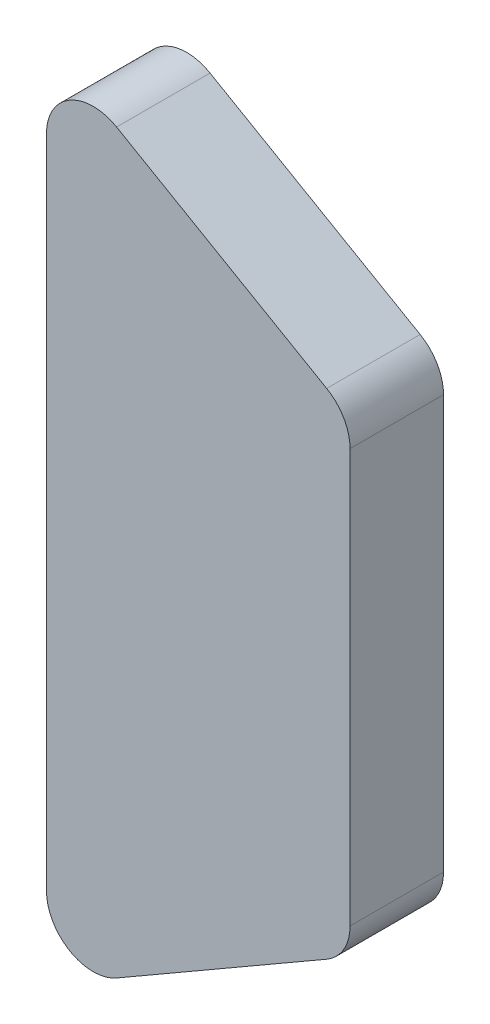
from build123d import *

# Parameters (mm, degrees)
Y_KSEKLIK_EKSTR_ZYON1_DEPTH = 2
RADYUS1_R                   = 1


with BuildPart() as part:
    # Çizim1 → Yükseklik-Ekstrüzyon1 (new body)
    with BuildSketch(Plane.XY):
        Polygon((0, -8.75), (0, 8.75), (6.495190528, 5), (6.495190528, -5), align=None)
    extrude(amount=Y_KSEKLIK_EKSTR_ZYON1_DEPTH)

    # Radyus1
    radyus1_edges = [part.edges().sort_by_distance(p)[0] for p in [
        (0, -8.75, 1),
        (0, 8.75, 1),
        (6.495190528, 5, 1),
        (6.495190528, -5, 1),
    ]]
    fillet(radyus1_edges, radius=RADYUS1_R)


solid = part.part
